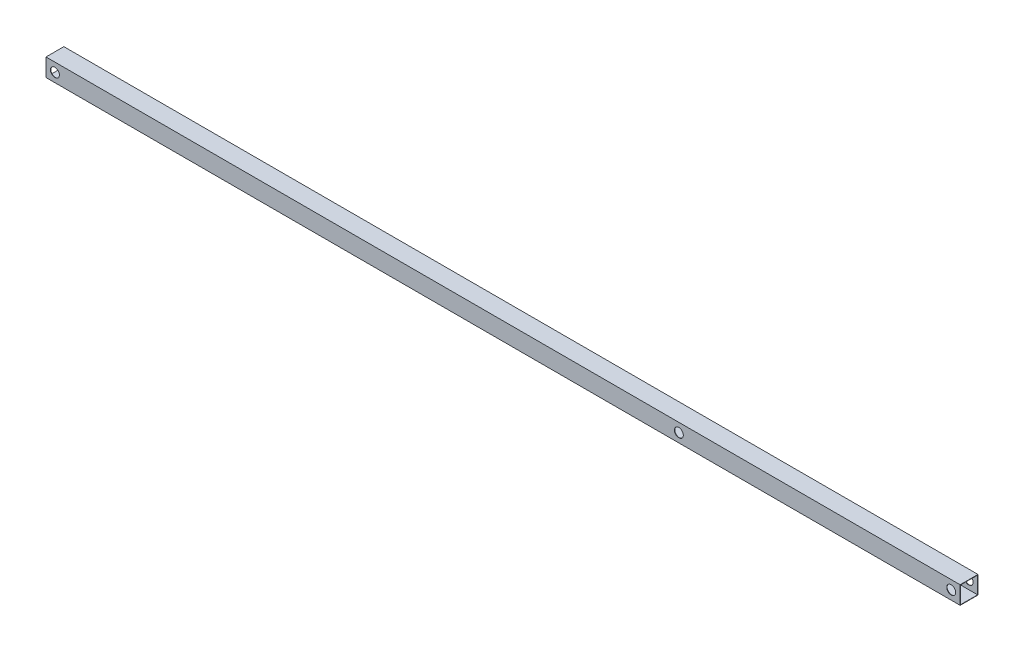
from build123d import *

# Parameters (mm, degrees)
SKETCH1_W                              = 25.4
SKETCH1_H                              = 25.4
SKETCH1_W_2                            = 24.2824
SKETCH1_H_2                            = 24.2824
AL_TUBE_SQUARE_1_SQ_X_022_WALL_3_DEPTH = 1300
CROQUIS3_R                             = 6.35
CORTAR_EXTRUIR1_DEPTH                  = 1301.310136083


with BuildPart() as part:
    # Sketch1 → Al tube (square) 1 SQ X .022 WALL(3) (new body)
    with BuildSketch(Plane.YZ):
        Rectangle(SKETCH1_W, SKETCH1_H)
        Rectangle(SKETCH1_W_2, SKETCH1_H_2, mode=Mode.SUBTRACT)
    extrude(amount=AL_TUBE_SQUARE_1_SQ_X_022_WALL_3_DEPTH)

    # Croquis3 → Cortar-Extruir1 (cut, through all)
    with BuildSketch(Plane.XY.offset(12.7)):
        with Locations((1287.3, 0)):
            Circle(CROQUIS3_R)
        with Locations((900, 0)):
            Circle(CROQUIS3_R)
        with Locations((12.7, 0)):
            Circle(CROQUIS3_R)
    extrude(amount=-CORTAR_EXTRUIR1_DEPTH, mode=Mode.SUBTRACT)


solid = part.part
